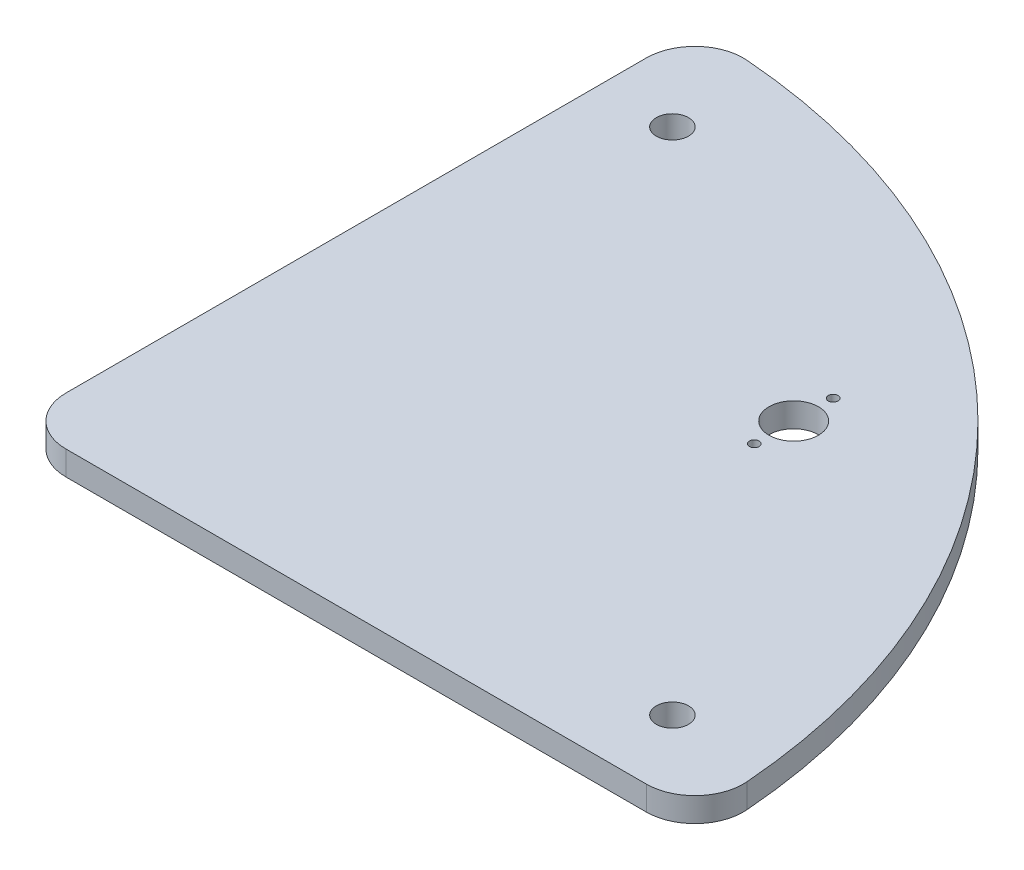
from build123d import *

# Parameters (mm, degrees)
BOSS_EXTRUDE1_DEPTH      = 3.175
SKETCH2_R                = 6.477
SKETCH2_R_2              = 1.27
CUT_EXTRUDE1_DEPTH       = 252.527339468
Q_0_332_DIAMETER_HOLE1_D = 8.4328
FILLET1_R                = 12.7


with BuildPart() as part:
    # Sketch1 → Boss-Extrude1 (new, symmetric)
    with BuildSketch(Plane(origin=(0, 0, 0), x_dir=(1, 0, 0), z_dir=(0, 1, 0))):
        with BuildLine():
            Line((0, 177.8), (0, 0))
            Line((0, 0), (177.8, 0))
            ThreePointArc((177.8, 0), (125.723585695, 125.723585695), (0, 177.8))
        make_face()
    extrude(amount=BOSS_EXTRUDE1_DEPTH, both=True)

    # Sketch2 → Cut-Extrude1 (cut, through all)
    with BuildSketch(Plane(origin=(0, 3.175, 0), x_dir=(1, 0, 0), z_dir=(0, 1, 0))):
        with Locations(Location((101.6, 101.6, 0), (0, 0, 270))):
            Circle(SKETCH2_R)
        with Locations(Location((101.6, 91.2749, 0), (0, 0, 270))):
            Circle(SKETCH2_R_2)
        with Locations(Location((101.6, 111.9251, 0), (0, 0, 270))):
            Circle(SKETCH2_R_2)
    extrude(amount=-CUT_EXTRUDE1_DEPTH, mode=Mode.SUBTRACT)

    # Q (0.332) Diameter Hole1 (through all)
    with Locations(Plane(origin=(0, 3.175, 0), x_dir=(1, 0, 0), z_dir=(0, 1, 0))):
        with Locations((19.05, 152.4), (152.4, 19.05)):
            Hole(Q_0_332_DIAMETER_HOLE1_D / 2)

    # Fillet1
    fillet1_edges = [part.edges().sort_by_distance(p)[0] for p in [
        (0, 0, 0),
        (0, 0, -177.8),
        (177.8, 0, 0),
    ]]
    fillet(fillet1_edges, radius=FILLET1_R)


solid = part.part
